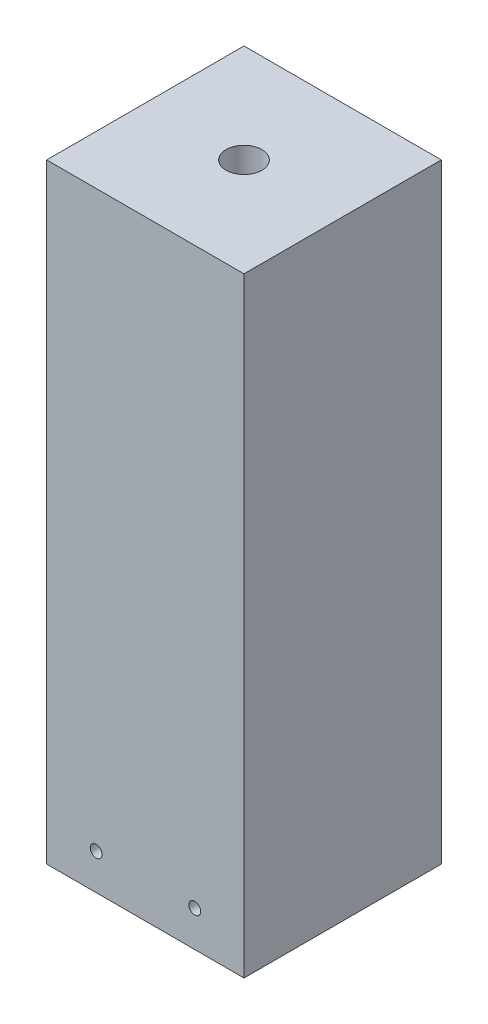
from build123d import *

# Parameters (mm, degrees)
SKETCH1_W                         = 55
SKETCH1_H                         = 55
BOSS_EXTRUDE1_DEPTH               = 170
SKETCH2_W                         = 46
SKETCH2_H                         = 46
CUT_EXTRUDE4_DEPTH                = 160
SKETCH5_W                         = 14.999999972
SKETCH5_H                         = 5
CUT_EXTRUDE5_DEPTH                = 4.5
TAP_DRILL_FOR_M4_TAP1_D           = 3.3
TAP_DRILL_FOR_M4_TAP1_CSINK_D     = 3.35
TAP_DRILL_FOR_M4_TAP1_CSINK_ANGLE = 90
SKETCH8_R                         = 5
CUT_EXTRUDE6_DEPTH                = 175.391800266


with BuildPart() as part:
    # Sketch1 → Boss-Extrude1 (new body)
    with BuildSketch(Plane(origin=(0, 0, 0), x_dir=(1, 0, 0), z_dir=(0, 1, 0))):
        Rectangle(SKETCH1_W, SKETCH1_H)
    extrude(amount=BOSS_EXTRUDE1_DEPTH)

    # Sketch2 → Cut-Extrude4 (cut)
    with BuildSketch(Plane(origin=(0, 0, 0), x_dir=(1, 0, 0), z_dir=(0, 1, 0))):
        Rectangle(SKETCH2_W, SKETCH2_H)
    extrude(amount=CUT_EXTRUDE4_DEPTH, mode=Mode.SUBTRACT)

    # Sketch5 → Cut-Extrude5 (cut)
    with BuildSketch(Plane.ZY.offset(27.5)):
        with Locations((1.4e-08, 145.67539027)):
            Rectangle(SKETCH5_W, SKETCH5_H)
    extrude(amount=-CUT_EXTRUDE5_DEPTH, mode=Mode.SUBTRACT)

    # Tap Drill for M4 Tap1 (through all)
    with Locations(Plane(origin=(13.784, 10.000000066, -27.5), x_dir=(-1, 0, 0), z_dir=(0, 0, -1))):
        with Locations((0, 0), (27.5, 0)):
            CounterSinkHole(TAP_DRILL_FOR_M4_TAP1_D / 2, TAP_DRILL_FOR_M4_TAP1_CSINK_D / 2, counter_sink_angle=TAP_DRILL_FOR_M4_TAP1_CSINK_ANGLE)

    # Sketch8 → Cut-Extrude6 (cut, through all)
    with BuildSketch(Plane(origin=(0, 170, 0), x_dir=(1, 0, 0), z_dir=(0, 1, 0))):
        with Locations(Location((0, 0, 0), (0, 0, 270))):
            Circle(SKETCH8_R)
    extrude(amount=-CUT_EXTRUDE6_DEPTH, mode=Mode.SUBTRACT)


solid = part.part
